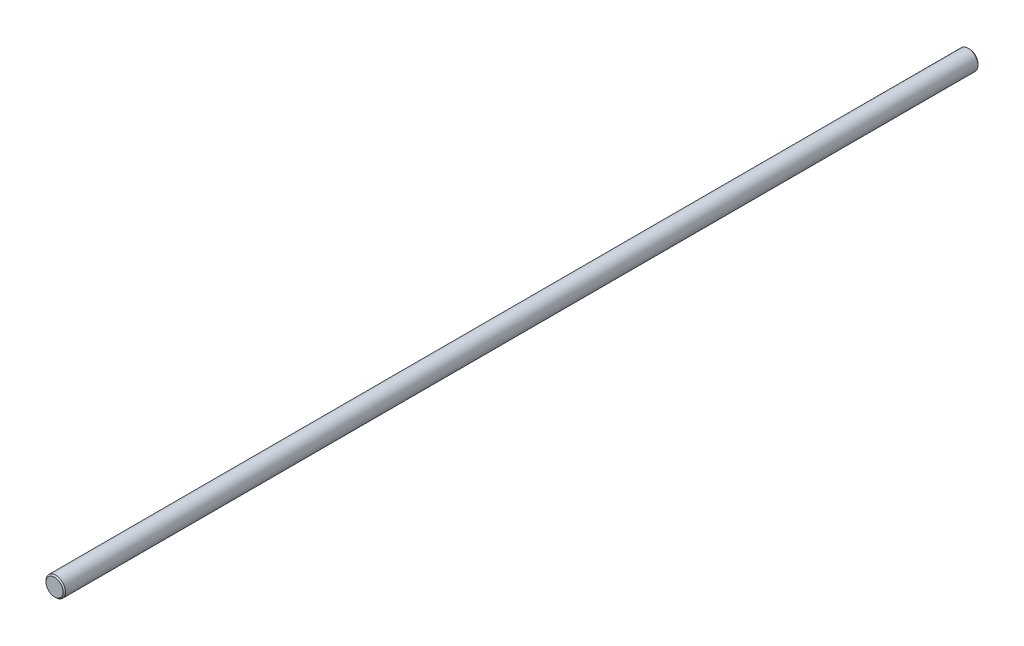
from build123d import *

# Parameters (mm, degrees)
SZKIC1_R                    = 4
DODANIE_WYCI_GNI_CIE1_DEPTH = 375
SFAZOWANIE1_SIZE            = 0.5


with BuildPart() as part:
    # Szkic1 → Dodanie-wyciągnięcie1 (new body)
    with BuildSketch(Plane.XY):
        Circle(SZKIC1_R)
    extrude(amount=DODANIE_WYCI_GNI_CIE1_DEPTH)

    # Sfazowanie1
    sfazowanie1_edges = [part.edges().sort_by_distance(p)[0] for p in [
        (-4, 0, 0),
        (-4, 0, 375),
    ]]
    chamfer(sfazowanie1_edges, length=SFAZOWANIE1_SIZE)


solid = part.part
